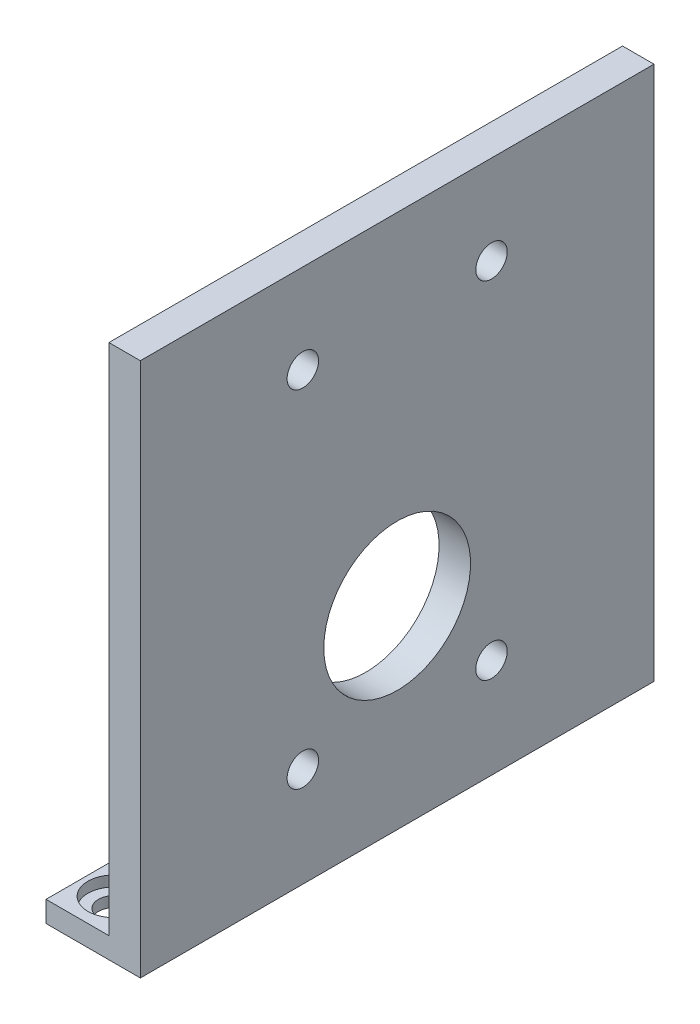
from build123d import *

# Parameters (mm, degrees)
SKETCH1_W           = 9
SKETCH1_H           = 49
BOSS_EXTRUDE1_DEPTH = 2
SKETCH2_W           = 3
SKETCH2_H           = 49
BOSS_EXTRUDE2_DEPTH = 49
SKETCH3_R           = 7
SKETCH3_R_2         = 1.5
CUT_EXTRUDE1_DEPTH  = 3
SKETCH4_R           = 2.5
CUT_EXTRUDE2_DEPTH  = 1
SKETCH5_R           = 1.5
CUT_EXTRUDE3_DEPTH  = 2
SKETCH6_R           = 1.5
CUT_EXTRUDE4_DEPTH  = 2


with BuildPart() as part:
    # Sketch1 → Boss-Extrude1 (new body)
    with BuildSketch(Plane(origin=(0, 0, 0), x_dir=(1, 0, 0), z_dir=(0, 1, 0))):
        Rectangle(SKETCH1_W, SKETCH1_H)
    extrude(amount=BOSS_EXTRUDE1_DEPTH)

    # Sketch2 → Boss-Extrude2 (add)
    with BuildSketch(Plane(origin=(0, 2, 0), x_dir=(1, 0, 0), z_dir=(0, 1, 0))):
        with Locations((3, 0)):
            Rectangle(SKETCH2_W, SKETCH2_H)
    extrude(amount=BOSS_EXTRUDE2_DEPTH)

    # Sketch3 → Cut-Extrude1 (cut)
    with BuildSketch(Plane.ZY.offset(-1.5)):
        with Locations((0, 18.5)):
            Circle(SKETCH3_R)
        with Locations((-9, 9.5)):
            Circle(SKETCH3_R_2)
        with Locations((9, 9.5)):
            Circle(SKETCH3_R_2)
        with Locations((-9, 42.5)):
            Circle(SKETCH3_R_2)
        with Locations((9, 42.5)):
            Circle(SKETCH3_R_2)
    extrude(amount=-CUT_EXTRUDE1_DEPTH, mode=Mode.SUBTRACT)

    # Sketch4 → Cut-Extrude2 (cut)
    with BuildSketch(Plane(origin=(0, 2, 0), x_dir=(1, 0, 0), z_dir=(0, 1, 0))):
        with Locations(Location((-1.5, 21, 0), (0, 0, 270))):
            Circle(SKETCH4_R)
        with Locations(Location((-1.5, -21, 0), (0, 0, 270))):
            Circle(SKETCH4_R)
    extrude(amount=-CUT_EXTRUDE2_DEPTH, mode=Mode.SUBTRACT)

    # Sketch5 → Cut-Extrude3 (cut)
    with BuildSketch(Plane(origin=(0, 1, 0), x_dir=(1, 0, 0), z_dir=(0, 1, 0))):
        with Locations(Location((-1.5, 21, 0), (0, 0, 270))):
            Circle(SKETCH5_R)
    extrude(amount=-CUT_EXTRUDE3_DEPTH, mode=Mode.SUBTRACT)

    # Sketch6 → Cut-Extrude4 (cut)
    with BuildSketch(Plane(origin=(0, 1, 0), x_dir=(1, 0, 0), z_dir=(0, 1, 0))):
        with Locations(Location((-1.5, -21, 0), (0, 0, 270))):
            Circle(SKETCH6_R)
    extrude(amount=-CUT_EXTRUDE4_DEPTH, mode=Mode.SUBTRACT)


solid = part.part
